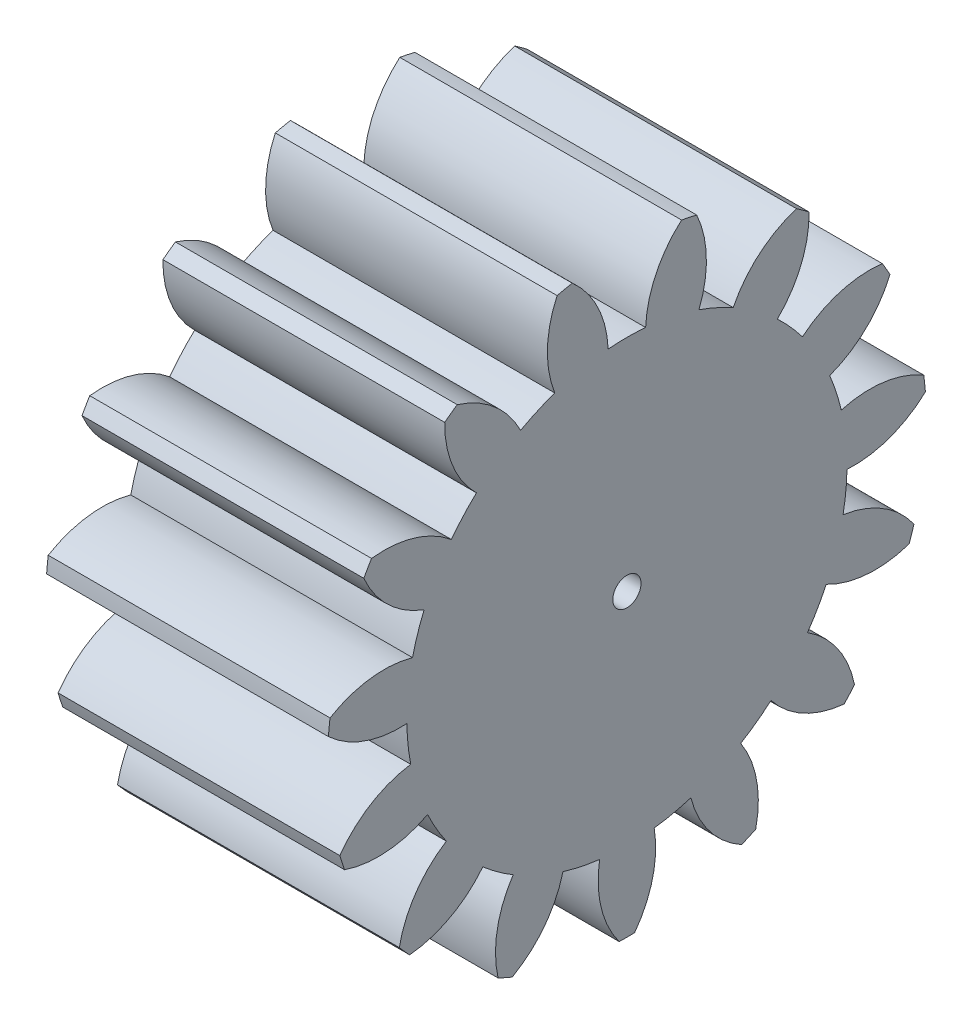
from build123d import *

# Parameters (mm, degrees)
BASPROSKE_W     = 8
BASPROSKE_H     = 8.5
TOOTHCUT_DEPTH  = 15.439529078
TEETHCUTS_COUNT = 15
TEETHCUTS_ANGLE = 336
BORSKE_R        = 0.4
BORE_DEPTH      = 50.0000508


with BuildPart() as part:
    # BasProSke → Base-Revolve (revolve)
    with BuildSketch(Plane(origin=(0, 0, 0), x_dir=(1, 0, 0), z_dir=(0, 1, 0)), mode=Mode.PRIVATE) as base_revolve_sk:
        with Locations((4, 4.25)):
            Rectangle(BASPROSKE_W, BASPROSKE_H)
    revolve(base_revolve_sk.sketch.rotate(Axis((-10, 0, 0), (1, 0, 0)), 180), axis=Axis((-10, 0, 0), (1, 0, 0)))

    # TooCutSke → ToothCut (cut, through all)
    with BuildSketch(Plane(origin=(0, 0, 0), x_dir=(0, 0, -1), z_dir=(1, 0, 0))):
        with BuildLine():
            ThreePointArc((0.531576138, 6.226349477), (0, 6.249), (-0.531576138, 6.226349477))
            ThreePointArc((-0.531576138, 6.226349477), (-0.830301624, 7.411024729), (-1.576608494, 8.378350125))
            ThreePointArc((-1.576608494, 8.378350125), (0, 8.5254), (1.576608494, 8.378350125))
            ThreePointArc((1.576608494, 8.378350125), (0.830301624, 7.411024729), (0.531576138, 6.226349477))
        make_face()
    toothcut = extrude(amount=TOOTHCUT_DEPTH, mode=Mode.SUBTRACT)

    # TeethCuts: ToothCut ×15 about axis
    teethcuts_axis = Axis((-10, 0, 0), (1, 0, 0))
    for i in range(1, TEETHCUTS_COUNT):
        add(toothcut.rotate(teethcuts_axis, i * TEETHCUTS_ANGLE / (TEETHCUTS_COUNT - 1)), mode=Mode.SUBTRACT)

    # BorSke → Bore (cut, symmetric)
    with BuildSketch(Plane(origin=(0, 0, 0), x_dir=(0, 0, -1), z_dir=(1, 0, 0))):
        with Locations(Location((0, 0, 0), (0, 0, 180))):
            Circle(BORSKE_R)
    extrude(amount=BORE_DEPTH, both=True, mode=Mode.SUBTRACT)


solid = part.part
